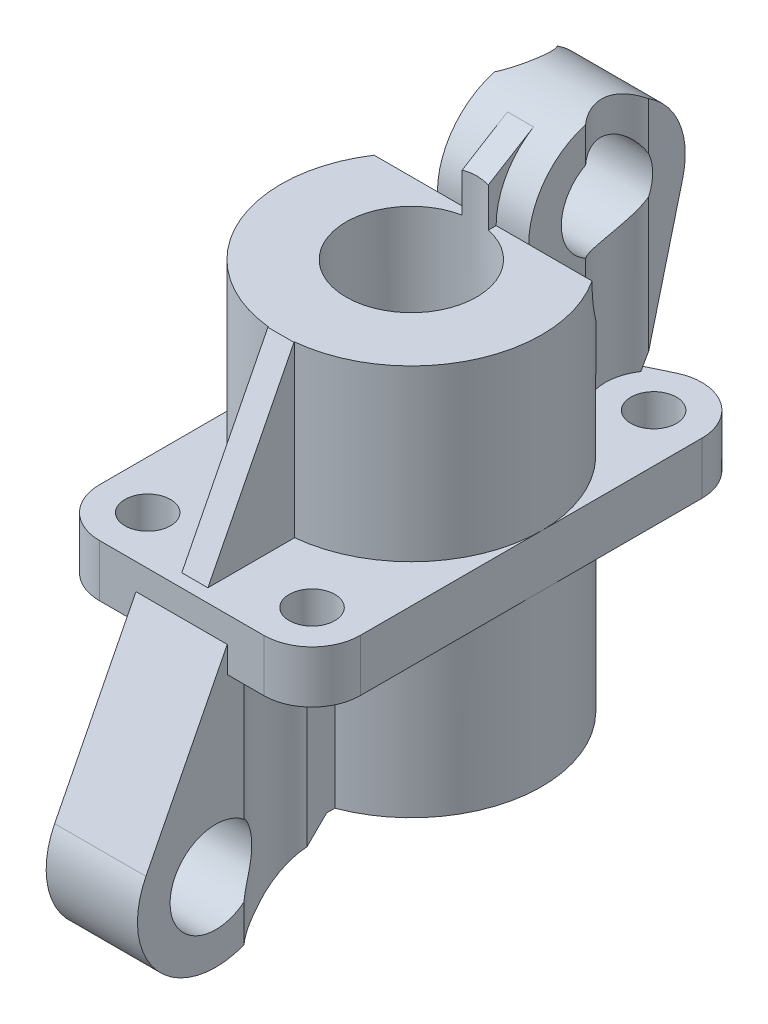
from build123d import *

# Parameters (mm, degrees)
SKETCH2_R                = 10
BOSS_EXTRUDE1_DEPTH      = 15
SKETCH3_R                = 3.5
BOSS_EXTRUDE2_DEPTH      = 1
SKETCH6_R                = 1.75
BOSS_EXTRUDE3_DEPTH      = 2
SKETCH9_R                = 3.5
BOSS_EXTRUDE4_DEPTH      = 3.5
CUT_EXTRUDE12_DEPTH      = 7.2
CUT_EXTRUDE3_DEPTH       = 45.679413626
CUT_EXTRUDE3_DEPTH_BACK  = 8
SKETCH14_R               = 6
CUT_EXTRUDE7_DEPTH       = 35.978564903
SKETCH15_R               = 6
CUT_EXTRUDE8_DEPTH       = 33.94692706
CUT_EXTRUDE2_DEPTH       = 45.679413626
CUT_EXTRUDE2_DEPTH_BACK  = 45.679413626
SKETCH8_R                = 5
SKETCH16_R               = 3.7
CUT_EXTRUDE9_DEPTH       = 36.060661745
SKETCH17_R               = 3.7
CUT_EXTRUDE10_DEPTH      = 36.060661811
CUT_EXTRUDE13_DEPTH      = 34.782392028
CUT_EXTRUDE13_DEPTH_BACK = 34.782392028
SKETCH21_R               = 3.5


with BuildPart() as part:
    # Sketch2 → Boss-Extrude1 (new, symmetric)
    with BuildSketch(Plane(origin=(0, 0, 0), x_dir=(1, 0, 0), z_dir=(0, 1, 0))):
        Circle(SKETCH2_R)
    extrude(amount=BOSS_EXTRUDE1_DEPTH, both=True)

    # Sketch3 → Boss-Extrude2 (add, symmetric)
    with BuildSketch(Plane(origin=(0, 0, 0), x_dir=(0, 0, -1), z_dir=(1, 0, 0))):
        with BuildLine():
            Line((10, -15), (-10, -15))
            Line((-10, -15), (-14.264705882, -19.249974557))
            ThreePointArc((-14.264705882, -19.249974557), (-22.027248631, -19.853711682), (-23.850142927, -12.284126171))
            Line((-23.850142927, -12.284126171), (-10, 15))
            Line((-10, 15), (0, 15))
            Line((0, 15), (8.369565217, 20.118630488))
            ThreePointArc((8.369565217, 20.118630488), (15.066233626, 19.825140177), (17.311895323, 13.509405234))
            Line((17.311895323, 13.509405234), (10, -15))
        make_face()
        with Locations((11.5, 15)):
            Circle(SKETCH3_R, mode=Mode.SUBTRACT)
        with Locations((-18.5, -15)):
            Circle(SKETCH3_R, mode=Mode.SUBTRACT)
    extrude(amount=BOSS_EXTRUDE2_DEPTH, both=True)

    # Sketch6 → Boss-Extrude3 (add, symmetric)
    with BuildSketch(Plane(origin=(0, 0, 0), x_dir=(1, 0, 0), z_dir=(0, 1, 0))):
        with BuildLine():
            Line((-4.705422643, 15.616789864), (-1, 13.847096386))
            Line((-1, 13.847096386), (1, 13.847096386))
            Line((1, 13.847096386), (4.705422643, 15.616789864))
            ThreePointArc((4.705422643, 15.616789864), (8.273583515, 15.407720534), (10, 12.278029158))
            Line((10, 12.278029158), (10, -13.9143961))
            ThreePointArc((10, -13.9143961), (8.91629509, -16.530691191), (6.3, -17.6143961))
            Line((6.3, -17.6143961), (-6.3, -17.6143961))
            ThreePointArc((-6.3, -17.6143961), (-8.91629509, -16.530691191), (-10, -13.9143961))
            Line((-10, -13.9143961), (-10, 12.278029158))
            ThreePointArc((-10, 12.278029158), (-8.273583515, 15.407720534), (-4.705422643, 15.616789864))
        make_face()
        with Locations((-6.3, 12.278029158)):
            Circle(SKETCH6_R, mode=Mode.SUBTRACT)
        with Locations((6.3, 12.278029158)):
            Circle(SKETCH6_R, mode=Mode.SUBTRACT)
        with Locations((6.3, -13.9143961)):
            Circle(SKETCH6_R, mode=Mode.SUBTRACT)
        with Locations((-6.3, -13.9143961)):
            Circle(SKETCH6_R, mode=Mode.SUBTRACT)
    extrude(amount=BOSS_EXTRUDE3_DEPTH, both=True)

    # Sketch9 → Boss-Extrude4 (add, symmetric)
    # profile 1 of 2: a face of its own
    with BuildSketch(Plane(origin=(0, 0, 0), x_dir=(0, 0, -1), z_dir=(1, 0, 0))):
        with BuildLine():
            Line((14.360042571, 2), (17.311895323, 13.509405234))
            ThreePointArc((17.311895323, 13.509405234), (12.251208381, 20.952788084), (5.5, 15))
            Line((5.5, 15), (5.5, 2))
            Line((5.5, 2), (14.360042571, 2))
        make_face()
        with Locations((11.5, 15)):
            Circle(SKETCH9_R, mode=Mode.SUBTRACT)
    # profile 2 of 2: a face of its own
    with BuildSketch(Plane(origin=(0, 0, 0), x_dir=(0, 0, -1), z_dir=(1, 0, 0))):
        with BuildLine():
            Line((-23.850142927, -12.284126171), (-17.6143961, 0))
            Line((-17.6143961, 0), (-7.949874371, 0))
            Line((-7.949874371, 0), (-7.949874371, -15))
            Line((-7.949874371, -15), (-10, -15))
            Line((-10, -15), (-14.264705882, -19.249974557))
            ThreePointArc((-14.264705882, -19.249974557), (-22.027248631, -19.853711682), (-23.850142927, -12.284126171))
        make_face()
        with Locations((-18.5, -15)):
            Circle(SKETCH9_R, mode=Mode.SUBTRACT)
    extrude(amount=BOSS_EXTRUDE4_DEPTH, both=True)

    # Sketch20 → Cut-Extrude12 (cut)
    with BuildSketch(Plane(origin=(0, 0, 0), x_dir=(1, 0, 0), z_dir=(0, 1, 0))):
        Polygon((0, -7.794228634), (6.75, -3.897114317), (6.75, 3.897114317), (0, 7.794228634), (-6.75, 3.897114317), (-6.75, -3.897114317), align=None)
    extrude(amount=CUT_EXTRUDE12_DEPTH, mode=Mode.SUBTRACT)

    # Sketch10 → Cut-Extrude3 (cut, two sides: drawn at the far end of the back side and taken through both)
    with BuildSketch(Plane.XZ.offset(15).offset(-CUT_EXTRUDE3_DEPTH_BACK)):
        Polygon((0, -7.794228634), (6.75, -3.897114317), (6.75, 3.897114317), (0, 7.794228634), (-6.75, 3.897114317), (-6.75, -3.897114317), align=None)
    extrude(amount=CUT_EXTRUDE3_DEPTH + CUT_EXTRUDE3_DEPTH_BACK, mode=Mode.SUBTRACT)

    # Sketch14 → Cut-Extrude7 (cut, through all)
    with BuildSketch(Plane(origin=(-3.5, 0, 0), x_dir=(0, 0, -1), z_dir=(1, 0, 0))):
        with Locations((11.5, 15)):
            Circle(SKETCH14_R)
        with Locations((-18.5, -15)):
            Circle(SKETCH14_R)
    extrude(amount=-CUT_EXTRUDE7_DEPTH, mode=Mode.SUBTRACT)

    # Sketch15 → Cut-Extrude8 (cut, through all)
    with BuildSketch(Plane(origin=(3.5, 0, 3), x_dir=(0, 0, 1), z_dir=(-1, 0, 0))):
        with Locations((15.5, -15)):
            Circle(SKETCH15_R)
        with Locations((-14.5, 15)):
            Circle(SKETCH15_R)
    extrude(amount=-CUT_EXTRUDE8_DEPTH, mode=Mode.SUBTRACT)

    # Sketch8 → Cut-Extrude2 (cut, two sides: drawn at the far end of the back side and taken through both)
    with BuildSketch(Plane(origin=(0, 15, 0), x_dir=(1, 0, 0), z_dir=(0, 1, 0)).offset(-CUT_EXTRUDE2_DEPTH_BACK)):
        Circle(SKETCH8_R)
    extrude(amount=CUT_EXTRUDE2_DEPTH + CUT_EXTRUDE2_DEPTH_BACK, mode=Mode.SUBTRACT)

    # Sketch16 → Cut-Extrude9 (cut, through all)
    with BuildSketch(Plane(origin=(0, 2, 0), x_dir=(1, 0, 0), z_dir=(0, 1, 0))):
        with Locations((6.3, 12.278029158)):
            Circle(SKETCH16_R)
        with Locations((-6.3, 12.278029158)):
            Circle(SKETCH16_R)
    extrude(amount=CUT_EXTRUDE9_DEPTH, mode=Mode.SUBTRACT)

    # Sketch17 → Cut-Extrude10 (cut, through all)
    with BuildSketch(Plane.XZ.offset(2)):
        with Locations((6.3, 13.9143961)):
            Circle(SKETCH17_R)
        with Locations((-6.3, 13.9143961)):
            Circle(SKETCH17_R)
        with Locations((6.3, -12.278029158)):
            Circle(SKETCH17_R)
        with Locations((-6.3, -12.278029158)):
            Circle(SKETCH17_R)
    extrude(amount=CUT_EXTRUDE10_DEPTH, mode=Mode.SUBTRACT)

    # Sketch21 → Cut-Extrude13 (cut, two sides: drawn at the far end of the back side and taken through both)
    with BuildSketch(Plane(origin=(0, 0, 0), x_dir=(0, 0, -1), z_dir=(1, 0, 0)).offset(-CUT_EXTRUDE13_DEPTH_BACK)):
        with Locations((11.5, 15)):
            Circle(SKETCH21_R)
    extrude(amount=CUT_EXTRUDE13_DEPTH + CUT_EXTRUDE13_DEPTH_BACK, mode=Mode.SUBTRACT)


solid = part.part
